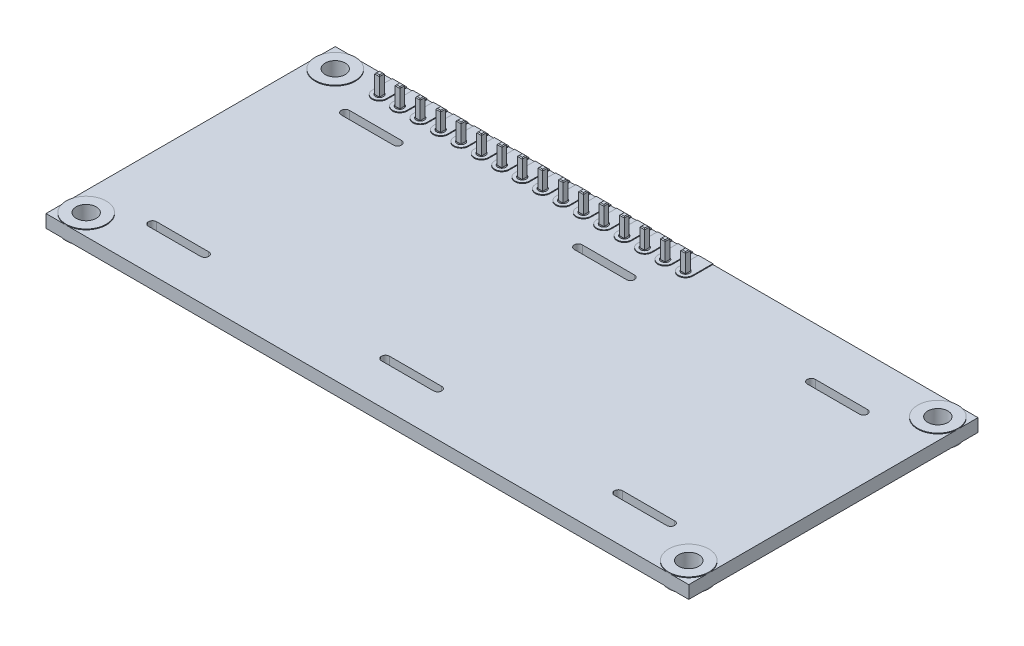
from build123d import *

# Parameters (mm, degrees)
SKETCH1_W                  = 80
SKETCH1_H                  = 36
SKETCH1_R                  = 1.25
SKETCH1_R_2                = 0.5
BOSS_EXTRUDE1_DEPTH        = 1.6
BOSS_EXTRUDE2_START        = 0.1
SKETCH2_R                  = 0.5
BOSS_EXTRUDE2_DEPTH        = 0.1
LPATTERN1_COUNT            = 16
LPATTERN1_PITCH            = 2.54
BOSS_EXTRUDE3_START        = 0.1
SKETCH3_R                  = 2.5
SKETCH3_R_2                = 1.25
BOSS_EXTRUDE3_DEPTH        = 0.1
SKETCH4_R                  = 2.5
SKETCH4_R_2                = 1.25
BOSS_EXTRUDE4_DEPTH        = 0.1
SKETCH5_W                  = 0.6
SKETCH5_H                  = 0.6
BOSS_EXTRUDE5_DEPTH        = 2.2
SKETCH6_W                  = 0.6
SKETCH6_H                  = 0.6
BOSS_EXTRUDE6_DEPTH        = 0.1
BOSS_EXTRUDE6_TAPER        = 45
SKETCH7_W                  = 0.6
SKETCH7_H                  = 0.6
BOSS_EXTRUDE7_DEPTH        = 0.1
BOSS_EXTRUDE7_TAPER        = 45
LPATTERN2_COUNT            = 16
LPATTERN2_PITCH            = 2.54
SKETCH8_W                  = 40.5
SKETCH8_H                  = 2.5
BOSS_EXTRUDE8_DEPTH        = 9
SKETCH9_W                  = 1
SKETCH9_H                  = 1
CUT_EXTRUDE1_DEPTH         = 8
CHAMFER1_SIZE              = 0.375
LPATTERN3_COUNT            = 16
LPATTERN3_PITCH            = 2.5
CHAMFER1_OF_LPATTERN3_SIZE = 0.375


with BuildPart() as part:
    # Sketch1 → Boss-Extrude1 (new body)
    with BuildSketch(Plane(origin=(0, 0, 0), x_dir=(1, 0, 0), z_dir=(0, 1, 0))):
        Rectangle(SKETCH1_W, SKETCH1_H)
        with Locations(Location((-37.5, 15.5, 0), (0, 0, 270))):
            Circle(SKETCH1_R, mode=Mode.SUBTRACT)
        with Locations(Location((-37.5, -15.5, 0), (0, 0, 270))):
            Circle(SKETCH1_R, mode=Mode.SUBTRACT)
        with Locations(Location((37.5, 15.5, 0), (0, 0, 270))):
            Circle(SKETCH1_R, mode=Mode.SUBTRACT)
        with Locations(Location((37.5, -15.5, 0), (0, 0, 270))):
            Circle(SKETCH1_R, mode=Mode.SUBTRACT)
        with Locations(Location((-32, 15.5, 0), (0, 0, 270))):
            Circle(SKETCH1_R_2, mode=Mode.SUBTRACT)
        with Locations(Location((-29.46, 15.5, 0), (0, 0, 270))):
            Circle(SKETCH1_R_2, mode=Mode.SUBTRACT)
        with Locations(Location((-26.92, 15.5, 0), (0, 0, 270))):
            Circle(SKETCH1_R_2, mode=Mode.SUBTRACT)
        with Locations(Location((-24.38, 15.5, 0), (0, 0, 270))):
            Circle(SKETCH1_R_2, mode=Mode.SUBTRACT)
        with Locations(Location((-21.84, 15.5, 0), (0, 0, 270))):
            Circle(SKETCH1_R_2, mode=Mode.SUBTRACT)
        with Locations(Location((-19.3, 15.5, 0), (0, 0, 270))):
            Circle(SKETCH1_R_2, mode=Mode.SUBTRACT)
        with Locations(Location((-16.76, 15.5, 0), (0, 0, 270))):
            Circle(SKETCH1_R_2, mode=Mode.SUBTRACT)
        with Locations(Location((-14.22, 15.5, 0), (0, 0, 270))):
            Circle(SKETCH1_R_2, mode=Mode.SUBTRACT)
        with Locations(Location((-11.68, 15.5, 0), (0, 0, 270))):
            Circle(SKETCH1_R_2, mode=Mode.SUBTRACT)
        with Locations(Location((-9.14, 15.5, 0), (0, 0, 270))):
            Circle(SKETCH1_R_2, mode=Mode.SUBTRACT)
        with Locations(Location((-6.6, 15.5, 0), (0, 0, 270))):
            Circle(SKETCH1_R_2, mode=Mode.SUBTRACT)
        with Locations(Location((-4.06, 15.5, 0), (0, 0, 270))):
            Circle(SKETCH1_R_2, mode=Mode.SUBTRACT)
        with Locations(Location((-1.52, 15.5, 0), (0, 0, 270))):
            Circle(SKETCH1_R_2, mode=Mode.SUBTRACT)
        with Locations(Location((1.02, 15.5, 0), (0, 0, 270))):
            Circle(SKETCH1_R_2, mode=Mode.SUBTRACT)
        with Locations(Location((3.56, 15.5, 0), (0, 0, 270))):
            Circle(SKETCH1_R_2, mode=Mode.SUBTRACT)
        with Locations(Location((6.1, 15.5, 0), (0, 0, 270))):
            Circle(SKETCH1_R_2, mode=Mode.SUBTRACT)
        with BuildLine():
            Line((-3.25, -12), (3.25, -12))
            ThreePointArc((3.25, -12), (3.75, -12.5), (3.25, -13))
            Line((3.25, -13), (-3.25, -13))
            ThreePointArc((-3.25, -13), (-3.75, -12.5), (-3.25, -12))
        make_face(mode=Mode.SUBTRACT)
        with BuildLine():
            Line((25.75, -12), (32.25, -12))
            ThreePointArc((32.25, -12), (32.75, -12.5), (32.25, -13))
            Line((32.25, -13), (25.75, -13))
            ThreePointArc((25.75, -13), (25.25, -12.5), (25.75, -12))
        make_face(mode=Mode.SUBTRACT)
        with BuildLine():
            Line((25.75, 12), (32.25, 12))
            ThreePointArc((32.25, 12), (32.75, 11.5), (32.25, 11))
            Line((32.25, 11), (25.75, 11))
            ThreePointArc((25.75, 11), (25.25, 11.5), (25.75, 12))
        make_face(mode=Mode.SUBTRACT)
        with BuildLine():
            Line((-3.25, 12), (3.25, 12))
            ThreePointArc((3.25, 12), (3.75, 11.5), (3.25, 11))
            Line((3.25, 11), (-3.25, 11))
            ThreePointArc((-3.25, 11), (-3.75, 11.5), (-3.25, 12))
        make_face(mode=Mode.SUBTRACT)
        with BuildLine():
            Line((-32.25, -12), (-25.75, -12))
            ThreePointArc((-25.75, -12), (-25.25, -12.5), (-25.75, -13))
            Line((-25.75, -13), (-32.25, -13))
            ThreePointArc((-32.25, -13), (-32.75, -12.5), (-32.25, -12))
        make_face(mode=Mode.SUBTRACT)
        with BuildLine():
            Line((-32.25, 12), (-25.75, 12))
            ThreePointArc((-25.75, 12), (-25.25, 11.5), (-25.75, 11))
            Line((-25.75, 11), (-32.25, 11))
            ThreePointArc((-32.25, 11), (-32.75, 11.5), (-32.25, 12))
        make_face(mode=Mode.SUBTRACT)
    extrude(amount=-BOSS_EXTRUDE1_DEPTH)

    # Sketch2 → Boss-Extrude2 (add)
    with BuildSketch(Plane(origin=(0, 0, 0), x_dir=(1, 0, 0), z_dir=(0, 1, 0)).offset(BOSS_EXTRUDE2_START)):
        with BuildLine():
            Line((-32.9, 15.5), (-32.9, 18))
            Line((-32.9, 18), (-31.1, 18))
            Line((-31.1, 18), (-31.1, 15.5))
            ThreePointArc((-31.1, 15.5), (-32, 14.6), (-32.9, 15.5))
        make_face()
        with Locations(Location((-32, 15.5, 0), (0, 0, 270))):
            Circle(SKETCH2_R, mode=Mode.SUBTRACT)
    boss_extrude2 = extrude(amount=-BOSS_EXTRUDE2_DEPTH)

    # LPattern1: Boss-Extrude2 ×16
    with Locations(*[(i * LPATTERN1_PITCH, 0, 0) for i in range(1, LPATTERN1_COUNT)]):
        add(boss_extrude2)

    # Sketch3 → Boss-Extrude3 (add)
    # profile 1 of 4: a face of its own
    with BuildSketch(Plane(origin=(0, 0, 0), x_dir=(1, 0, 0), z_dir=(0, 1, 0)).offset(BOSS_EXTRUDE3_START)):
        with Locations(Location((-37.5, 15.5, 0), (0, 0, 90))):
            Circle(SKETCH3_R)
        with Locations(Location((-37.5, 15.5, 0), (0, 0, 270))):
            Circle(SKETCH3_R_2, mode=Mode.SUBTRACT)
    # profile 2 of 4: a face of its own
    with BuildSketch(Plane(origin=(0, 0, 0), x_dir=(1, 0, 0), z_dir=(0, 1, 0)).offset(BOSS_EXTRUDE3_START)):
        with Locations(Location((-37.5, -15.5, 0), (0, 0, 270))):
            Circle(SKETCH3_R)
        with Locations(Location((-37.5, -15.5, 0), (0, 0, 270))):
            Circle(SKETCH3_R_2, mode=Mode.SUBTRACT)
    # profile 3 of 4: a face of its own
    with BuildSketch(Plane(origin=(0, 0, 0), x_dir=(1, 0, 0), z_dir=(0, 1, 0)).offset(BOSS_EXTRUDE3_START)):
        with Locations(Location((37.5, -15.5, 0), (0, 0, 270))):
            Circle(SKETCH3_R)
        with Locations(Location((37.5, -15.5, 0), (0, 0, 270))):
            Circle(SKETCH3_R_2, mode=Mode.SUBTRACT)
    # profile 4 of 4: a face of its own
    with BuildSketch(Plane(origin=(0, 0, 0), x_dir=(1, 0, 0), z_dir=(0, 1, 0)).offset(BOSS_EXTRUDE3_START)):
        with Locations(Location((37.5, 15.5, 0), (0, 0, 90))):
            Circle(SKETCH3_R)
        with Locations(Location((37.5, 15.5, 0), (0, 0, 270))):
            Circle(SKETCH3_R_2, mode=Mode.SUBTRACT)
    extrude(amount=-BOSS_EXTRUDE3_DEPTH)

    # Sketch4 → Boss-Extrude4 (add)
    # profile 1 of 4: a face of its own
    with BuildSketch(Plane.XZ.offset(1.6)):
        with Locations(Location((37.5, -15.5, 0), (0, 0, 270))):
            Circle(SKETCH4_R)
        with Locations(Location((37.5, -15.5, 0), (0, 0, 90))):
            Circle(SKETCH4_R_2, mode=Mode.SUBTRACT)
    # profile 2 of 4: a face of its own
    with BuildSketch(Plane.XZ.offset(1.6)):
        with Locations(Location((37.5, 15.5, 0), (0, 0, 90))):
            Circle(SKETCH4_R)
        with Locations(Location((37.5, 15.5, 0), (0, 0, 90))):
            Circle(SKETCH4_R_2, mode=Mode.SUBTRACT)
    # profile 3 of 4: a face of its own
    with BuildSketch(Plane.XZ.offset(1.6)):
        with Locations(Location((-37.5, 15.5, 0), (0, 0, 90))):
            Circle(SKETCH4_R)
        with Locations(Location((-37.5, 15.5, 0), (0, 0, 90))):
            Circle(SKETCH4_R_2, mode=Mode.SUBTRACT)
    # profile 4 of 4: a face of its own
    with BuildSketch(Plane.XZ.offset(1.6)):
        with Locations(Location((-37.5, -15.5, 0), (0, 0, 270))):
            Circle(SKETCH4_R)
        with Locations(Location((-37.5, -15.5, 0), (0, 0, 90))):
            Circle(SKETCH4_R_2, mode=Mode.SUBTRACT)
    extrude(amount=BOSS_EXTRUDE4_DEPTH)

    # Sketch8 → Boss-Extrude8 (add)
    with BuildSketch(Plane.XZ.offset(1.6)):
        with Locations((-13, -15.5)):
            Rectangle(SKETCH8_W, SKETCH8_H)
    extrude(amount=BOSS_EXTRUDE8_DEPTH)

    # Sketch9 → Cut-Extrude1 (cut)
    with BuildSketch(Plane.XZ.offset(10.6)):
        with Locations((-31.75, -15.5)):
            Rectangle(SKETCH9_W, SKETCH9_H)
    cut_extrude1 = extrude(amount=-CUT_EXTRUDE1_DEPTH, mode=Mode.SUBTRACT)

    # Chamfer1
    chamfer1_edges = [part.edges().sort_by_distance(p)[0] for p in [
        (-31.25, -10.6, -15.5),
        (-31.75, -10.6, -15),
        (-32.25, -10.6, -15.5),
        (-31.75, -10.6, -16),
    ]]
    chamfer(chamfer1_edges, length=CHAMFER1_SIZE)

    # LPattern3: Cut-Extrude1 ×16
    with Locations(*[(i * LPATTERN3_PITCH, 0, 0) for i in range(1, LPATTERN3_COUNT)]):
        add(cut_extrude1, mode=Mode.SUBTRACT)

    # Chamfer1 of LPattern3
    chamfer1_of_lpattern3_edges = [part.edges().sort_by_distance(p)[0] for p in [
        (-28.75, -10.6, -15.5),
        (-29.25, -10.6, -15),
        (-29.75, -10.6, -15.5),
        (-29.25, -10.6, -16),
        (-26.25, -10.6, -15.5),
        (-26.75, -10.6, -15),
        (-27.25, -10.6, -15.5),
        (-26.75, -10.6, -16),
        (-23.75, -10.6, -15.5),
        (-24.25, -10.6, -15),
        (-24.75, -10.6, -15.5),
        (-24.25, -10.6, -16),
        (-21.25, -10.6, -15.5),
        (-21.75, -10.6, -15),
        (-22.25, -10.6, -15.5),
        (-21.75, -10.6, -16),
        (-18.75, -10.6, -15.5),
        (-19.25, -10.6, -15),
        (-19.75, -10.6, -15.5),
        (-19.25, -10.6, -16),
        (-16.25, -10.6, -15.5),
        (-16.75, -10.6, -15),
        (-17.25, -10.6, -15.5),
        (-16.75, -10.6, -16),
        (-13.75, -10.6, -15.5),
        (-14.25, -10.6, -15),
        (-14.75, -10.6, -15.5),
        (-14.25, -10.6, -16),
        (-11.25, -10.6, -15.5),
        (-11.75, -10.6, -15),
        (-12.25, -10.6, -15.5),
        (-11.75, -10.6, -16),
        (-8.75, -10.6, -15.5),
        (-9.25, -10.6, -15),
        (-9.75, -10.6, -15.5),
        (-9.25, -10.6, -16),
        (-6.25, -10.6, -15.5),
        (-6.75, -10.6, -15),
        (-7.25, -10.6, -15.5),
        (-6.75, -10.6, -16),
        (-3.75, -10.6, -15.5),
        (-4.25, -10.6, -15),
        (-4.75, -10.6, -15.5),
        (-4.25, -10.6, -16),
        (-1.25, -10.6, -15.5),
        (-1.75, -10.6, -15),
        (-2.25, -10.6, -15.5),
        (-1.75, -10.6, -16),
        (1.25, -10.6, -15.5),
        (0.75, -10.6, -15),
        (0.25, -10.6, -15.5),
        (0.75, -10.6, -16),
        (3.75, -10.6, -15.5),
        (3.25, -10.6, -15),
        (2.75, -10.6, -15.5),
        (3.25, -10.6, -16),
        (6.25, -10.6, -15.5),
        (5.75, -10.6, -15),
        (5.25, -10.6, -15.5),
        (5.75, -10.6, -16),
    ]]
    chamfer(chamfer1_of_lpattern3_edges, length=CHAMFER1_OF_LPATTERN3_SIZE)


with BuildPart() as body_2:
    # Sketch5 → Boss-Extrude5 (new body)
    with BuildSketch(Plane(origin=(0, 0.1, 0), x_dir=(1, 0, 0), z_dir=(0, 1, 0))):
        with Locations((-32, 15.5)):
            Rectangle(SKETCH5_W, SKETCH5_H)
    boss_extrude5 = extrude(amount=BOSS_EXTRUDE5_DEPTH)

    # Sketch6 → Boss-Extrude6 (add)
    with BuildSketch(Plane(origin=(0, 2.3, 0), x_dir=(1, 0, 0), z_dir=(0, 1, 0))):
        with Locations((-32, 15.5)):
            Rectangle(SKETCH6_W, SKETCH6_H)
    boss_extrude6 = extrude(amount=BOSS_EXTRUDE6_DEPTH, taper=BOSS_EXTRUDE6_TAPER)

    # Sketch7 → Boss-Extrude7 (add)
    with BuildSketch(Plane.XZ.offset(-0.1)):
        with Locations((-32, -15.5)):
            Rectangle(SKETCH7_W, SKETCH7_H)
    boss_extrude7 = extrude(amount=BOSS_EXTRUDE7_DEPTH, taper=BOSS_EXTRUDE7_TAPER)


with BuildPart() as lpattern2_1:
    # LPattern2: Boss-Extrude5, Boss-Extrude6, Boss-Extrude7 ×16
    with Locations(*[(i * LPATTERN2_PITCH, 0, 0) for i in range(1, LPATTERN2_COUNT)]):
        add(boss_extrude5)
        add(boss_extrude6)
        add(boss_extrude7)


solid = Compound([part.part, body_2.part, lpattern2_1.part])
